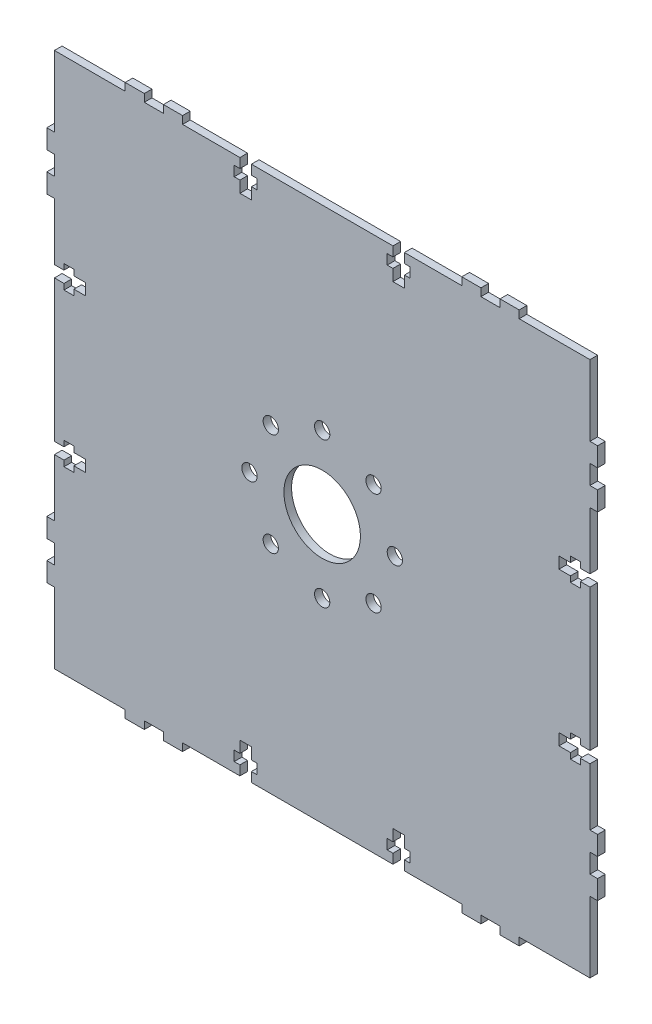
from build123d import *

# Parameters (mm, degrees)
SKETCH_1_R      = 10
SKETCH_1_R_2    = 2
EXTRUDE_1_DEPTH = 2


with BuildPart() as part:
    # 草图1 → 凸台-拉伸1 (new body)
    with BuildSketch(Plane.XY):
        Polygon((317.453360513, 257.462931603), (317.453360513, 258.962931603), (314.853360513, 258.962931603), (314.853360513, 257.462931603), (311.853360513, 257.462931603), (311.853360513, 254.462931603), (314.853360513, 254.462931603), (314.853360513, 252.962931603), (317.453360513, 252.962931603), (317.453360513, 254.462931603), (319.953360513, 254.462931603), (319.953360513, 239.462931603), (321.953360513, 239.462931603), (321.953360513, 234.462931603), (319.953360513, 234.462931603), (319.953360513, 229.462931603), (321.953360513, 229.462931603), (321.953360513, 224.462931603), (319.953360513, 224.462931603), (319.953360513, 205.962931603), (301.453360513, 205.962931603), (301.453360513, 203.962931603), (296.453360513, 203.962931603), (296.453360513, 205.962931603), (291.453360513, 205.962931603), (291.453360513, 203.962931603), (286.453360513, 203.962931603), (286.453360513, 205.962931603), (271.453360513, 205.962931603), (271.453360513, 208.462931603), (272.953360513, 208.462931603), (272.953360513, 211.062931603), (271.453360513, 211.062931603), (271.453360513, 214.062931603), (268.453360513, 214.062931603), (268.453360513, 211.062931603), (266.953360513, 211.062931603), (266.953360513, 208.462931603), (268.453360513, 208.462931603), (268.453360513, 205.962931603), (231.453360513, 205.962931603), (231.453360513, 208.462931603), (232.953360513, 208.462931603), (232.953360513, 211.062931603), (231.453360513, 211.062931603), (231.453360513, 214.062931603), (228.453360513, 214.062931603), (228.453360513, 211.062931603), (226.953360513, 211.062931603), (226.953360513, 208.462931603), (228.453360513, 208.462931603), (228.453360513, 205.962931603), (213.453360513, 205.962931603), (213.453360513, 203.962931603), (208.453360513, 203.962931603), (208.453360513, 205.962931603), (203.453360513, 205.962931603), (203.453360513, 203.962931603), (198.453360513, 203.962931603), (198.453360513, 205.962931603), (179.953360513, 205.962931603), (179.953360513, 224.462931603), (177.953360513, 224.462931603), (177.953360513, 229.462931603), (179.953360513, 229.462931603), (179.953360513, 234.462931603), (177.953360513, 234.462931603), (177.953360513, 239.462931603), (179.953360513, 239.462931603), (179.953360513, 254.462931603), (182.453360513, 254.462931603), (182.453360513, 252.962931603), (185.053360513, 252.962931603), (185.053360513, 254.462931603), (188.053360513, 254.462931603), (188.053360513, 257.462931603), (185.053360513, 257.462931603), (185.053360513, 258.962931603), (182.453360513, 258.962931603), (182.453360513, 257.462931603), (179.953360513, 257.462931603), (179.953360513, 294.462931603), (182.453360513, 294.462931603), (182.453360513, 292.962931603), (185.053360513, 292.962931603), (185.053360513, 294.462931603), (188.053360513, 294.462931603), (188.053360513, 297.462931603), (185.053360513, 297.462931603), (185.053360513, 298.962931603), (182.453360513, 298.962931603), (182.453360513, 297.462931603), (179.953360513, 297.462931603), (179.953360513, 312.462931603), (177.953360513, 312.462931603), (177.953360513, 317.462931603), (179.953360513, 317.462931603), (179.953360513, 322.462931603), (177.953360513, 322.462931603), (177.953360513, 327.462931603), (179.953360513, 327.462931603), (179.953360513, 345.962931603), (198.453360513, 345.962931603), (198.453360513, 347.962931603), (203.453360513, 347.962931603), (203.453360513, 345.962931603), (208.453360513, 345.962931603), (208.453360513, 347.962931603), (213.453360513, 347.962931603), (213.453360513, 345.962931603), (228.453360513, 345.962931603), (228.453360513, 343.462931603), (226.953360513, 343.462931603), (226.953360513, 340.862931603), (228.453360513, 340.862931603), (228.453360513, 337.862931603), (231.453360513, 337.862931603), (231.453360513, 340.862931603), (232.953360513, 340.862931603), (232.953360513, 343.462931603), (231.453360513, 343.462931603), (231.453360513, 345.962931603), (268.453360513, 345.962931603), (268.453360513, 343.462931603), (266.953360513, 343.462931603), (266.953360513, 340.862931603), (268.453360513, 340.862931603), (268.453360513, 337.862931603), (271.453360513, 337.862931603), (271.453360513, 340.862931603), (272.953360513, 340.862931603), (272.953360513, 343.462931603), (271.453360513, 343.462931603), (271.453360513, 345.962931603), (286.453360513, 345.962931603), (286.453360513, 347.962931603), (291.453360513, 347.962931603), (291.453360513, 345.962931603), (296.453360513, 345.962931603), (296.453360513, 347.962931603), (301.453360513, 347.962931603), (301.453360513, 345.962931603), (319.953360513, 345.962931603), (319.953360513, 327.462931603), (321.953360513, 327.462931603), (321.953360513, 322.462931603), (319.953360513, 322.462931603), (319.953360513, 317.462931603), (321.953360513, 317.462931603), (321.953360513, 312.462931603), (319.953360513, 312.462931603), (319.953360513, 297.462931603), (317.453360513, 297.462931603), (317.453360513, 298.962931603), (314.853360513, 298.962931603), (314.853360513, 297.462931603), (311.853360513, 297.462931603), (311.853360513, 294.462931603), (314.853360513, 294.462931603), (314.853360513, 292.962931603), (317.453360513, 292.962931603), (317.453360513, 294.462931603), (319.953360513, 294.462931603), (319.953360513, 257.462931603), align=None)
        with Locations((249.953360513, 275.962931603)):
            Circle(SKETCH_1_R, mode=Mode.SUBTRACT)
        with Locations((230.953360513, 275.962931603)):
            Circle(SKETCH_1_R_2, mode=Mode.SUBTRACT)
        with Locations((236.518331671, 289.397960445)):
            Circle(SKETCH_1_R_2, mode=Mode.SUBTRACT)
        with Locations((249.953360513, 294.962931603)):
            Circle(SKETCH_1_R_2, mode=Mode.SUBTRACT)
        with Locations((263.388389356, 289.397960445)):
            Circle(SKETCH_1_R_2, mode=Mode.SUBTRACT)
        with Locations((268.953360513, 275.962931603)):
            Circle(SKETCH_1_R_2, mode=Mode.SUBTRACT)
        with Locations((263.388389356, 262.52790276)):
            Circle(SKETCH_1_R_2, mode=Mode.SUBTRACT)
        with Locations((249.953360513, 256.962931603)):
            Circle(SKETCH_1_R_2, mode=Mode.SUBTRACT)
        with Locations((236.518331671, 262.52790276)):
            Circle(SKETCH_1_R_2, mode=Mode.SUBTRACT)
    extrude(amount=EXTRUDE_1_DEPTH)


solid = part.part
